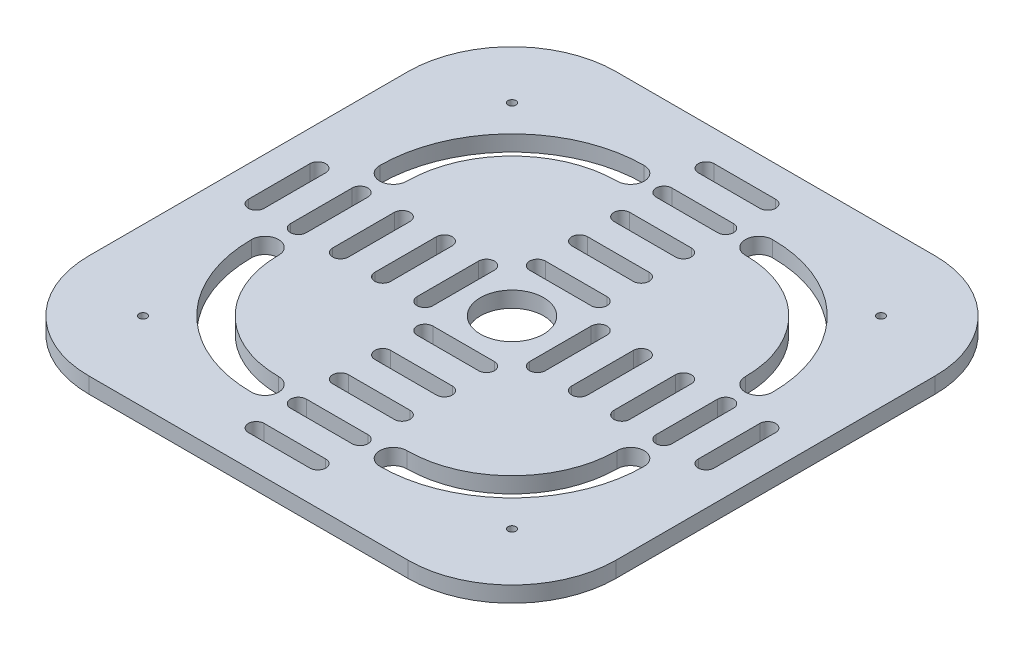
from build123d import *

# Parameters (mm, degrees)
IZIM1_W                     = 100
IZIM1_H                     = 100
IZIM1_R                     = 0.75
Y_KSEKLIK_EKSTR_ZYON1_DEPTH = 3
IZIM2_R                     = 6
KES_EKSTR_ZYON1_DEPTH       = 4
KES_EKSTR_ZYON2_DEPTH       = 4
KES_EKSTR_ZYON3_DEPTH       = 4


with BuildPart() as part:
    # Çizim1 → Yükseklik-Ekstrüzyon1 (new body)
    with BuildSketch(Plane(origin=(0, 0, 0), x_dir=(1, 0, 0), z_dir=(0, 1, 0))):
        Rectangle(IZIM1_W, IZIM1_H)
        with Locations(Location((-35, 35, 0), (0, 0, 270))):
            Circle(IZIM1_R, mode=Mode.SUBTRACT)
        with Locations(Location((35, 35, 0), (0, 0, 270))):
            Circle(IZIM1_R, mode=Mode.SUBTRACT)
        with Locations(Location((35, -35, 0), (0, 0, 270))):
            Circle(IZIM1_R, mode=Mode.SUBTRACT)
        with Locations(Location((-35, -35, 0), (0, 0, 270))):
            Circle(IZIM1_R, mode=Mode.SUBTRACT)
    extrude(amount=-Y_KSEKLIK_EKSTR_ZYON1_DEPTH)

    # Çizim2 → Kes-Ekstrüzyon1 (cut)
    with BuildSketch(Plane(origin=(0, 0, 0), x_dir=(1, 0, 0), z_dir=(0, 1, 0))):
        with Locations(Location((0, 0, 0), (0, 0, 270))):
            Circle(IZIM2_R)
    extrude(amount=-KES_EKSTR_ZYON1_DEPTH, mode=Mode.SUBTRACT)

    # Çizim3 → Kes-Ekstrüzyon2 (cut)
    with BuildSketch(Plane(origin=(0, 0, 0), x_dir=(1, 0, 0), z_dir=(0, 1, 0))):
        with BuildLine():
            Line((-50, 30.263704164), (-50, 50))
            Line((-50, 50), (-30.263704164, 50))
            ThreePointArc((-30.263704164, 50), (-44.219372785, 44.219372785), (-50, 30.263704164))
        make_face()
        with BuildLine():
            Line((50, 50), (50, 30.263704164))
            ThreePointArc((50, 30.263704164), (44.219372785, 44.219372785), (30.263704164, 50))
            Line((30.263704164, 50), (50, 50))
        make_face()
        with BuildLine():
            Line((50, -50), (30.263704164, -50))
            ThreePointArc((30.263704164, -50), (44.219372785, -44.219372785), (50, -30.263704164))
            Line((50, -30.263704164), (50, -50))
        make_face()
        with BuildLine():
            Line((-50, -50), (-50, -30.263704164))
            ThreePointArc((-50, -30.263704164), (-44.219372785, -44.219372785), (-30.263704164, -50))
            Line((-30.263704164, -50), (-50, -50))
        make_face()
    extrude(amount=-KES_EKSTR_ZYON2_DEPTH, mode=Mode.SUBTRACT)

    # Çizim4 → Kes-Ekstrüzyon3 (cut)
    with BuildSketch(Plane(origin=(0, 0, 0), x_dir=(1, 0, 0), z_dir=(0, 1, 0))):
        with BuildLine():
            Line((-9.174701876, -5.841446321), (-9.174701876, 5.841446321))
            ThreePointArc((-9.174701876, 5.841446321), (-10.674701876, 7.341446321), (-12.174701876, 5.841446321))
            Line((-12.174701876, 5.841446321), (-12.174701876, -5.841446321))
            ThreePointArc((-12.174701876, -5.841446321), (-10.674701876, -7.341446321), (-9.174701876, -5.841446321))
        make_face()
        with BuildLine():
            Line((-17.174701876, -5.841446321), (-17.174701876, 5.841446321))
            ThreePointArc((-17.174701876, 5.841446321), (-18.674701876, 7.341446321), (-20.174701876, 5.841446321))
            Line((-20.174701876, 5.841446321), (-20.174701876, -5.841446321))
            ThreePointArc((-20.174701876, -5.841446321), (-18.674701876, -7.341446321), (-17.174701876, -5.841446321))
        make_face()
        with BuildLine():
            Line((-25.174701876, -5.841446321), (-25.174701876, 5.841446321))
            ThreePointArc((-25.174701876, 5.841446321), (-26.674701876, 7.341446321), (-28.174701876, 5.841446321))
            Line((-28.174701876, 5.841446321), (-28.174701876, -5.841446321))
            ThreePointArc((-28.174701876, -5.841446321), (-26.674701876, -7.341446321), (-25.174701876, -5.841446321))
        make_face()
        with BuildLine():
            Line((-33.174701876, -5.841446321), (-33.174701876, 5.841446321))
            ThreePointArc((-33.174701876, 5.841446321), (-34.674701876, 7.341446321), (-36.174701876, 5.841446321))
            Line((-36.174701876, 5.841446321), (-36.174701876, -5.841446321))
            ThreePointArc((-36.174701876, -5.841446321), (-34.674701876, -7.341446321), (-33.174701876, -5.841446321))
        make_face()
        with BuildLine():
            Line((-41.174701876, -5.841446321), (-41.174701876, 5.841446321))
            ThreePointArc((-41.174701876, 5.841446321), (-42.674701876, 7.341446321), (-44.174701876, 5.841446321))
            Line((-44.174701876, 5.841446321), (-44.174701876, -5.841446321))
            ThreePointArc((-44.174701876, -5.841446321), (-42.674701876, -7.341446321), (-41.174701876, -5.841446321))
        make_face()
        with BuildLine():
            Line((-5.841446321, 9.174701876), (5.841446321, 9.174701876))
            ThreePointArc((5.841446321, 9.174701876), (7.341446321, 10.674701876), (5.841446321, 12.174701876))
            Line((5.841446321, 12.174701876), (-5.841446321, 12.174701876))
            ThreePointArc((-5.841446321, 12.174701876), (-7.341446321, 10.674701876), (-5.841446321, 9.174701876))
        make_face()
        with BuildLine():
            Line((-5.841446321, 17.174701876), (5.841446321, 17.174701876))
            ThreePointArc((5.841446321, 17.174701876), (7.341446321, 18.674701876), (5.841446321, 20.174701876))
            Line((5.841446321, 20.174701876), (-5.841446321, 20.174701876))
            ThreePointArc((-5.841446321, 20.174701876), (-7.341446321, 18.674701876), (-5.841446321, 17.174701876))
        make_face()
        with BuildLine():
            Line((-5.841446321, 25.174701876), (5.841446321, 25.174701876))
            ThreePointArc((5.841446321, 25.174701876), (7.341446321, 26.674701876), (5.841446321, 28.174701876))
            Line((5.841446321, 28.174701876), (-5.841446321, 28.174701876))
            ThreePointArc((-5.841446321, 28.174701876), (-7.341446321, 26.674701876), (-5.841446321, 25.174701876))
        make_face()
        with BuildLine():
            Line((-5.841446321, 33.174701876), (5.841446321, 33.174701876))
            ThreePointArc((5.841446321, 33.174701876), (7.341446321, 34.674701876), (5.841446321, 36.174701876))
            Line((5.841446321, 36.174701876), (-5.841446321, 36.174701876))
            ThreePointArc((-5.841446321, 36.174701876), (-7.341446321, 34.674701876), (-5.841446321, 33.174701876))
        make_face()
        with BuildLine():
            Line((-5.841446321, 41.174701876), (5.841446321, 41.174701876))
            ThreePointArc((5.841446321, 41.174701876), (7.341446321, 42.674701876), (5.841446321, 44.174701876))
            Line((5.841446321, 44.174701876), (-5.841446321, 44.174701876))
            ThreePointArc((-5.841446321, 44.174701876), (-7.341446321, 42.674701876), (-5.841446321, 41.174701876))
        make_face()
        with BuildLine():
            Line((9.174701876, 5.841446321), (9.174701876, -5.841446321))
            ThreePointArc((9.174701876, -5.841446321), (10.674701876, -7.341446321), (12.174701876, -5.841446321))
            Line((12.174701876, -5.841446321), (12.174701876, 5.841446321))
            ThreePointArc((12.174701876, 5.841446321), (10.674701876, 7.341446321), (9.174701876, 5.841446321))
        make_face()
        with BuildLine():
            Line((17.174701876, 5.841446321), (17.174701876, -5.841446321))
            ThreePointArc((17.174701876, -5.841446321), (18.674701876, -7.341446321), (20.174701876, -5.841446321))
            Line((20.174701876, -5.841446321), (20.174701876, 5.841446321))
            ThreePointArc((20.174701876, 5.841446321), (18.674701876, 7.341446321), (17.174701876, 5.841446321))
        make_face()
        with BuildLine():
            Line((25.174701876, 5.841446321), (25.174701876, -5.841446321))
            ThreePointArc((25.174701876, -5.841446321), (26.674701876, -7.341446321), (28.174701876, -5.841446321))
            Line((28.174701876, -5.841446321), (28.174701876, 5.841446321))
            ThreePointArc((28.174701876, 5.841446321), (26.674701876, 7.341446321), (25.174701876, 5.841446321))
        make_face()
        with BuildLine():
            Line((33.174701876, 5.841446321), (33.174701876, -5.841446321))
            ThreePointArc((33.174701876, -5.841446321), (34.674701876, -7.341446321), (36.174701876, -5.841446321))
            Line((36.174701876, -5.841446321), (36.174701876, 5.841446321))
            ThreePointArc((36.174701876, 5.841446321), (34.674701876, 7.341446321), (33.174701876, 5.841446321))
        make_face()
        with BuildLine():
            Line((41.174701876, 5.841446321), (41.174701876, -5.841446321))
            ThreePointArc((41.174701876, -5.841446321), (42.674701876, -7.341446321), (44.174701876, -5.841446321))
            Line((44.174701876, -5.841446321), (44.174701876, 5.841446321))
            ThreePointArc((44.174701876, 5.841446321), (42.674701876, 7.341446321), (41.174701876, 5.841446321))
        make_face()
        with BuildLine():
            Line((5.841446321, -9.174701876), (-5.841446321, -9.174701876))
            ThreePointArc((-5.841446321, -9.174701876), (-7.341446321, -10.674701876), (-5.841446321, -12.174701876))
            Line((-5.841446321, -12.174701876), (5.841446321, -12.174701876))
            ThreePointArc((5.841446321, -12.174701876), (7.341446321, -10.674701876), (5.841446321, -9.174701876))
        make_face()
        with BuildLine():
            Line((5.841446321, -17.174701876), (-5.841446321, -17.174701876))
            ThreePointArc((-5.841446321, -17.174701876), (-7.341446321, -18.674701876), (-5.841446321, -20.174701876))
            Line((-5.841446321, -20.174701876), (5.841446321, -20.174701876))
            ThreePointArc((5.841446321, -20.174701876), (7.341446321, -18.674701876), (5.841446321, -17.174701876))
        make_face()
        with BuildLine():
            Line((5.841446321, -25.174701876), (-5.841446321, -25.174701876))
            ThreePointArc((-5.841446321, -25.174701876), (-7.341446321, -26.674701876), (-5.841446321, -28.174701876))
            Line((-5.841446321, -28.174701876), (5.841446321, -28.174701876))
            ThreePointArc((5.841446321, -28.174701876), (7.341446321, -26.674701876), (5.841446321, -25.174701876))
        make_face()
        with BuildLine():
            Line((5.841446321, -33.174701876), (-5.841446321, -33.174701876))
            ThreePointArc((-5.841446321, -33.174701876), (-7.341446321, -34.674701876), (-5.841446321, -36.174701876))
            Line((-5.841446321, -36.174701876), (5.841446321, -36.174701876))
            ThreePointArc((5.841446321, -36.174701876), (7.341446321, -34.674701876), (5.841446321, -33.174701876))
        make_face()
        with BuildLine():
            Line((5.841446321, -41.174701876), (-5.841446321, -41.174701876))
            ThreePointArc((-5.841446321, -41.174701876), (-7.341446321, -42.674701876), (-5.841446321, -44.174701876))
            Line((-5.841446321, -44.174701876), (5.841446321, -44.174701876))
            ThreePointArc((5.841446321, -44.174701876), (7.341446321, -42.674701876), (5.841446321, -41.174701876))
        make_face()
        with BuildLine():
            ThreePointArc((-12.174701876, 32.099731448), (-9.599731448, 34.674701876), (-12.174701876, 37.249672305))
            ThreePointArc((-12.174701876, 37.249672305), (-29.905383504, 29.905383504), (-37.249672305, 12.174701876))
            ThreePointArc((-37.249672305, 12.174701876), (-34.674701876, 9.599731448), (-32.099731448, 12.174701876))
            ThreePointArc((-32.099731448, 12.174701876), (-26.263825402, 26.263825402), (-12.174701876, 32.099731448))
        make_face()
        with BuildLine():
            ThreePointArc((32.099731448, 12.174701876), (34.674701876, 9.599731448), (37.249672305, 12.174701876))
            ThreePointArc((37.249672305, 12.174701876), (29.905383504, 29.905383504), (12.174701876, 37.249672305))
            ThreePointArc((12.174701876, 37.249672305), (9.599731448, 34.674701876), (12.174701876, 32.099731448))
            ThreePointArc((12.174701876, 32.099731448), (26.263825402, 26.263825402), (32.099731448, 12.174701876))
        make_face()
        with BuildLine():
            ThreePointArc((12.174701876, -32.099731448), (9.599731448, -34.674701876), (12.174701876, -37.249672305))
            ThreePointArc((12.174701876, -37.249672305), (29.905383504, -29.905383504), (37.249672305, -12.174701876))
            ThreePointArc((37.249672305, -12.174701876), (34.674701876, -9.599731448), (32.099731448, -12.174701876))
            ThreePointArc((32.099731448, -12.174701876), (26.263825402, -26.263825402), (12.174701876, -32.099731448))
        make_face()
        with BuildLine():
            ThreePointArc((-32.099731448, -12.174701876), (-34.674701876, -9.599731448), (-37.249672305, -12.174701876))
            ThreePointArc((-37.249672305, -12.174701876), (-29.905383504, -29.905383504), (-12.174701876, -37.249672305))
            ThreePointArc((-12.174701876, -37.249672305), (-9.599731448, -34.674701876), (-12.174701876, -32.099731448))
            ThreePointArc((-12.174701876, -32.099731448), (-26.263825402, -26.263825402), (-32.099731448, -12.174701876))
        make_face()
    extrude(amount=-KES_EKSTR_ZYON3_DEPTH, mode=Mode.SUBTRACT)


solid = part.part
